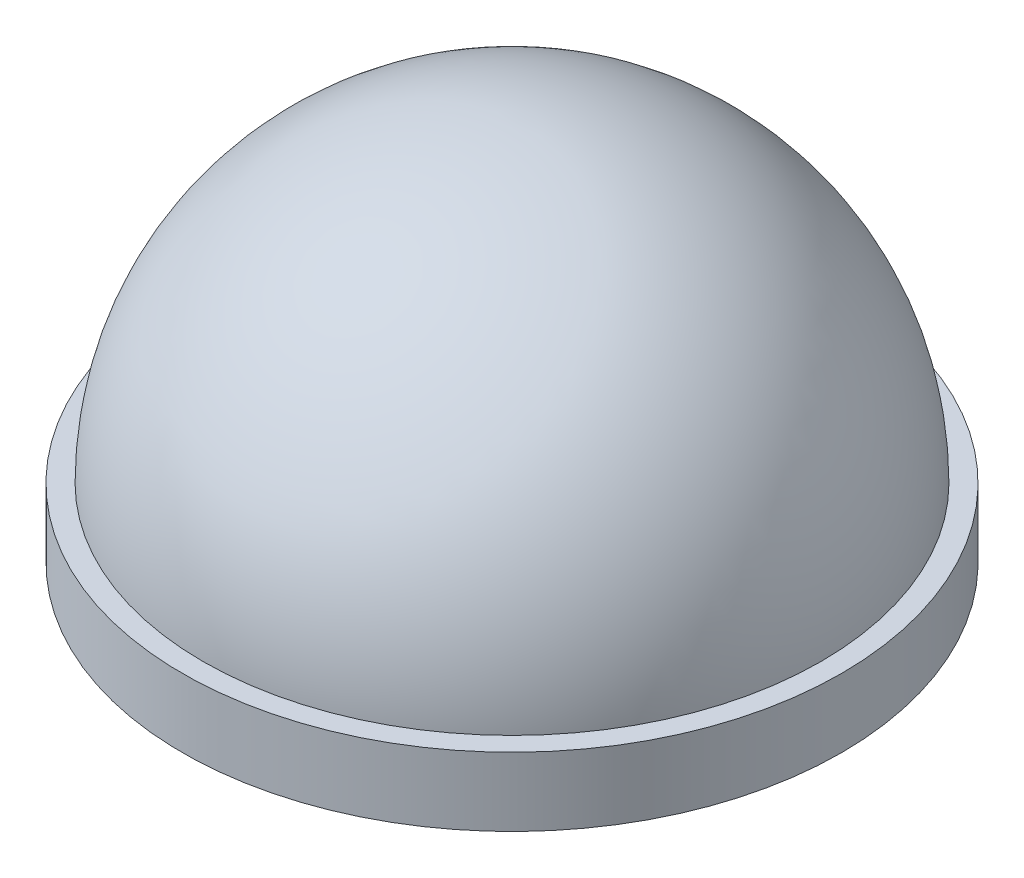
from build123d import *


with BuildPart() as part:
    # Croquis1 → Revolución1 (revolve)
    with BuildSketch(Plane.XY, mode=Mode.PRIVATE) as revoluci_n1_sk:
        with BuildLine():
            Line((0, 0), (-4.8, 0))
            Line((-4.8, 0), (-4.8, 1))
            Line((-4.8, 1), (-4.5, 1))
            ThreePointArc((-4.5, 1), (-3.181980515, 4.181980515), (0, 5.5))
            Line((0, 5.5), (0, 0))
        make_face()
    revolve(revoluci_n1_sk.sketch.rotate(Axis((0, 5.5, 0), (0, -1, 0)), 180), axis=Axis((0, 5.5, 0), (0, -1, 0)))


solid = part.part
